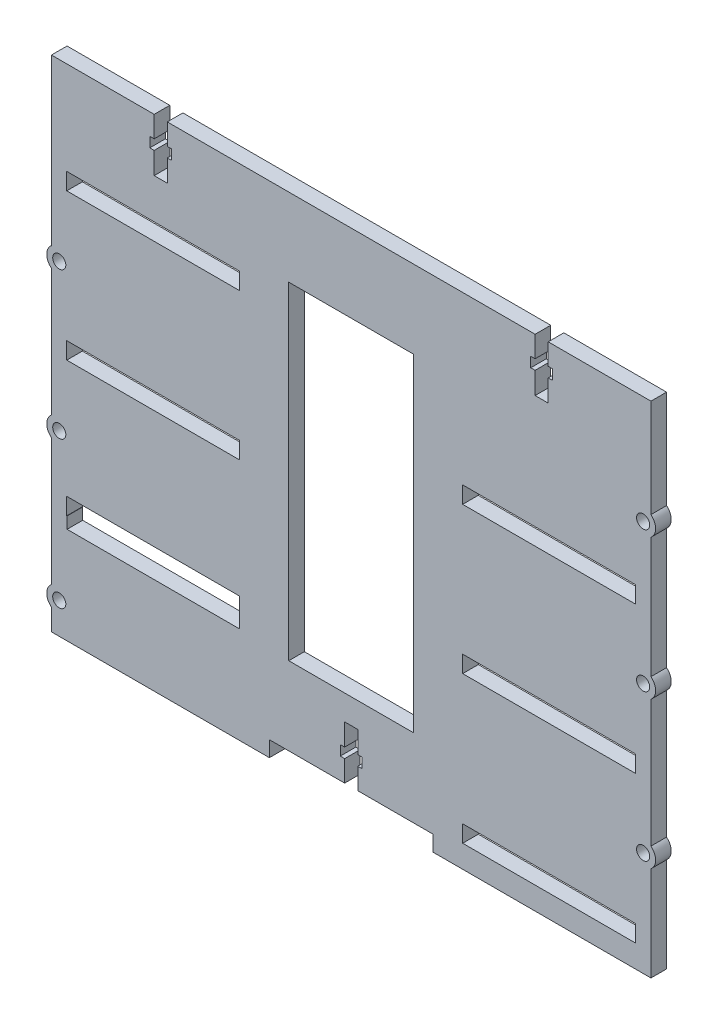
from build123d import *

# Parameters (mm, degrees)
SKETCH1_R           = 2.1
SKETCH1_W           = 55.2
SKETCH1_H           = 5.05
BOSS_EXTRUDE1_DEPTH = 5
SKETCH2_W           = 55.4
SKETCH2_H           = 5.4
CUT_EXTRUDE1_DEPTH  = 10
SKETCH3_W           = 52.4
SKETCH3_H           = 5
CUT_EXTRUDE2_DEPTH  = 10
SKETCH4_W           = 40
SKETCH4_H           = 105
CUT_EXTRUDE3_DEPTH  = 10


with BuildPart() as part:
    # Sketch1 → Boss-Extrude1 (new body)
    with BuildSketch(Plane.XY):
        with BuildLine():
            Line((-192, 100.877501001), (-192, 60.122498999))
            ThreePointArc((-192, 60.122498999), (-193.5, 57), (-192, 53.877501001))
            Line((-192, 53.877501001), (-192, 13.122498999))
            ThreePointArc((-192, 13.122498999), (-193.5, 10), (-192, 6.877501001))
            Line((-192, 6.877501001), (-192, 0))
            Line((-192, 0), (-122, 0))
            Line((-122, 0), (-122, 5))
            Line((-122, 5), (-98.1, 5))
            Line((-98.1, 5), (-98.1, 11.8))
            Line((-98.1, 11.8), (-99.5, 11.8))
            Line((-99.5, 11.8), (-99.5, 15))
            Line((-99.5, 15), (-98.1, 15))
            Line((-98.1, 15), (-98.1, 22))
            Line((-98.1, 22), (-93.9, 22))
            Line((-93.9, 22), (-93.9, 15))
            Line((-93.9, 15), (-92.5, 15))
            Line((-92.5, 15), (-92.5, 11.8))
            Line((-92.5, 11.8), (-93.9, 11.8))
            Line((-93.9, 11.8), (-93.9, 5))
            Line((-93.9, 5), (-70, 5))
            Line((-70, 5), (-70, 0))
            Line((-70, 0), (0, 0))
            Line((0, 0), (0, 30.327501001))
            ThreePointArc((0, 30.327501001), (1.5, 33.45), (0, 36.572498999))
            Line((0, 36.572498999), (0, 77.327501001))
            ThreePointArc((0, 77.327501001), (1.5, 80.45), (0, 83.572498999))
            Line((0, 83.572498999), (0, 122.277501001))
            ThreePointArc((0, 122.277501001), (1.5, 125.4), (0, 128.522498999))
            Line((0, 128.522498999), (0, 160))
            Line((0, 160), (-32.9, 160))
            Line((-32.9, 160), (-32.9, 153.2))
            Line((-32.9, 153.2), (-31.5, 153.2))
            Line((-31.5, 153.2), (-31.5, 150))
            Line((-31.5, 150), (-32.9, 150))
            Line((-32.9, 150), (-32.9, 143))
            Line((-32.9, 143), (-37.1, 143))
            Line((-37.1, 143), (-37.1, 150))
            Line((-37.1, 150), (-38.5, 150))
            Line((-38.5, 150), (-38.5, 153.2))
            Line((-38.5, 153.2), (-37.1, 153.2))
            Line((-37.1, 153.2), (-37.1, 160))
            Line((-37.1, 160), (-154.9, 160))
            Line((-154.9, 160), (-154.9, 153.2))
            Line((-154.9, 153.2), (-153.5, 153.2))
            Line((-153.5, 153.2), (-153.5, 150))
            Line((-153.5, 150), (-154.9, 150))
            Line((-154.9, 150), (-154.9, 143))
            Line((-154.9, 143), (-159.1, 143))
            Line((-159.1, 143), (-159.1, 150))
            Line((-159.1, 150), (-160.5, 150))
            Line((-160.5, 150), (-160.5, 153.2))
            Line((-160.5, 153.2), (-159.1, 153.2))
            Line((-159.1, 153.2), (-159.1, 160))
            Line((-159.1, 160), (-192, 160))
            Line((-192, 160), (-192, 107.122498999))
            ThreePointArc((-192, 107.122498999), (-193.5, 104), (-192, 100.877501001))
        make_face()
        with Locations((-189.5, 104)):
            Circle(SKETCH1_R, mode=Mode.SUBTRACT)
        with Locations((-189.5, 57)):
            Circle(SKETCH1_R, mode=Mode.SUBTRACT)
        with Locations((-189.5, 10)):
            Circle(SKETCH1_R, mode=Mode.SUBTRACT)
        with Locations((-2.5, 125.4)):
            Circle(SKETCH1_R, mode=Mode.SUBTRACT)
        with Locations((-2.5, 80.45)):
            Circle(SKETCH1_R, mode=Mode.SUBTRACT)
        with Locations((-2.5, 33.45)):
            Circle(SKETCH1_R, mode=Mode.SUBTRACT)
        with Locations((-159.4, 127.475)):
            Rectangle(SKETCH1_W, SKETCH1_H, mode=Mode.SUBTRACT)
        with Locations((-159.4, 80.475)):
            Rectangle(SKETCH1_W, SKETCH1_H, mode=Mode.SUBTRACT)
        with Locations((-159.4, 33.475)):
            Rectangle(SKETCH1_W, SKETCH1_H, mode=Mode.SUBTRACT)
        with Locations((-32.6, 103.925)):
            Rectangle(SKETCH1_W, SKETCH1_H, mode=Mode.SUBTRACT)
        with Locations((-32.6, 56.925)):
            Rectangle(SKETCH1_W, SKETCH1_H, mode=Mode.SUBTRACT)
        with Locations((-32.6, 9.925)):
            Rectangle(SKETCH1_W, SKETCH1_H, mode=Mode.SUBTRACT)
    extrude(amount=BOSS_EXTRUDE1_DEPTH)

    # Sketch2 → Cut-Extrude1 (cut)
    with BuildSketch(Plane.XY.offset(5)):
        with Locations((-159.4, 127.475)):
            Rectangle(SKETCH2_W, SKETCH2_H)
        with Locations((-32.6, 103.925)):
            Rectangle(SKETCH2_W, SKETCH2_H)
        with Locations((-159.4, 80.525)):
            Rectangle(SKETCH2_W, SKETCH2_H)
        with Locations((-159.4, 37.347324844)):
            Rectangle(SKETCH2_W, SKETCH2_H)
        with Locations((-32.6, 56.975)):
            Rectangle(SKETCH2_W, SKETCH2_H)
        with Locations((-32.6, 9.925)):
            Rectangle(SKETCH2_W, SKETCH2_H)
    extrude(amount=-CUT_EXTRUDE1_DEPTH, mode=Mode.SUBTRACT)

    # Sketch3 → Cut-Extrude2 (cut)
    with BuildSketch(Plane.XY.offset(5)):
        with Locations((-96, 2.5)):
            Rectangle(SKETCH3_W, SKETCH3_H)
    extrude(amount=-CUT_EXTRUDE2_DEPTH, mode=Mode.SUBTRACT)

    # Sketch4 → Cut-Extrude3 (cut)
    with BuildSketch(Plane.XY.offset(5)):
        with Locations((-96, 82.5)):
            Rectangle(SKETCH4_W, SKETCH4_H)
    extrude(amount=-CUT_EXTRUDE3_DEPTH, mode=Mode.SUBTRACT)


solid = part.part
